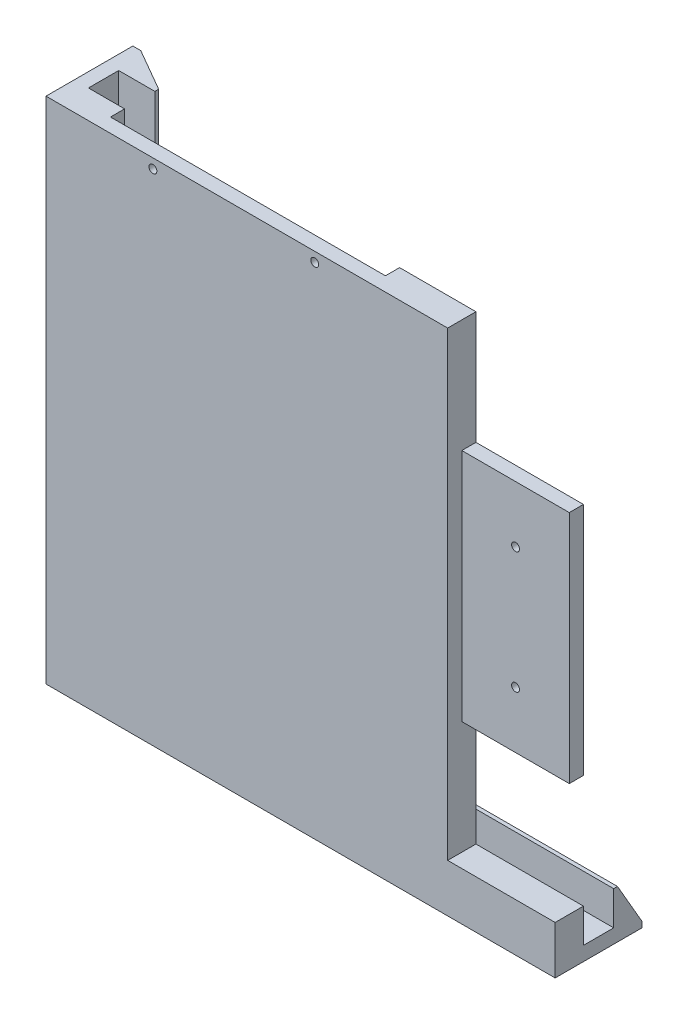
from build123d import *

# Parameters (mm, degrees)
CROQUIS1_W              = 180
CROQUIS1_H              = 180
SALIENTE_EXTRUIR1_DEPTH = 30.7
CROQUIS2_W              = 162.21
CROQUIS2_H              = 162.99
CORTAR_EXTRUIR1_DEPTH   = 20.7
CROQUIS4_W              = 175
CROQUIS4_H              = 10.7
CORTAR_EXTRUIR2_DEPTH   = 175
CROQUIS5_W              = 38
CROQUIS5_H              = 40
CORTAR_EXTRUIR3_DEPTH   = 10
CROQUIS6_W              = 38
CROQUIS6_H              = 82.99
CORTAR_EXTRUIR4_DEPTH   = 5
CROQUIS7_W              = 97.21
CROQUIS7_H              = 6.8
CORTAR_EXTRUIR5_DEPTH   = 5
CHAFL_N1_SIZE           = 15
CHAFL_N1_SIZE2          = 8.660254038
CROQUIS8_R              = 1.4
CORTAR_EXTRUIR6_DEPTH   = 20


with BuildPart() as part:
    # Croquis1 → Saliente-Extruir1 (new body)
    with BuildSketch(Plane.XY):
        with Locations((90, 90)):
            Rectangle(CROQUIS1_W, CROQUIS1_H)
    extrude(amount=SALIENTE_EXTRUIR1_DEPTH)

    # Croquis2 → Cortar-Extruir1 (cut)
    with BuildSketch(Plane(origin=(0, 0, 0), x_dir=(-1, 0, 0), z_dir=(0, 0, -1))):
        with Locations((-98.895, 98.505)):
            Rectangle(CROQUIS2_W, CROQUIS2_H)
    extrude(amount=-CORTAR_EXTRUIR1_DEPTH, mode=Mode.SUBTRACT)

    # Croquis4 → Cortar-Extruir2 (cut)
    with BuildSketch(Plane(origin=(0, 180, 0), x_dir=(1, 0, 0), z_dir=(0, 1, 0))):
        with Locations((92.5, -15.35)):
            Rectangle(CROQUIS4_W, CROQUIS4_H)
    extrude(amount=-CORTAR_EXTRUIR2_DEPTH, mode=Mode.SUBTRACT)

    # Croquis5 → Cortar-Extruir3 (cut)
    with BuildSketch(Plane(origin=(0, 0, 20.7), x_dir=(-1, 0, 0), z_dir=(0, 0, -1))):
        with Locations((-161, 160)):
            Rectangle(CROQUIS5_W, CROQUIS5_H)
        with Locations((-161, 37.01)):
            Rectangle(CROQUIS5_W, CROQUIS5_H)
    extrude(amount=-CORTAR_EXTRUIR3_DEPTH, mode=Mode.SUBTRACT)

    # Croquis6 → Cortar-Extruir4 (cut)
    with BuildSketch(Plane.XY.offset(30.7)):
        with Locations((161, 98.505)):
            Rectangle(CROQUIS6_W, CROQUIS6_H)
    extrude(amount=-CORTAR_EXTRUIR4_DEPTH, mode=Mode.SUBTRACT)

    # Croquis7 → Cortar-Extruir5 (cut)
    with BuildSketch(Plane(origin=(0, 0, 20.7), x_dir=(-1, 0, 0), z_dir=(0, 0, -1))):
        with Locations((-66.395, 176.6)):
            Rectangle(CROQUIS7_W, CROQUIS7_H)
    extrude(amount=-CORTAR_EXTRUIR5_DEPTH, mode=Mode.SUBTRACT)

    # Chaflán1
    chafl_n1_edges = [part.edges().sort_by_distance(p)[0] for p in [
        (98.895, 17.01, 0),
        (17.79, 98.505, 0),
    ]]
    chafl_n1_side = [part.faces().sort_by_distance(p)[0] for p in [
        (2.545584412, 90, 0),
    ]]
    chamfer(chafl_n1_edges, length=CHAFL_N1_SIZE, length2=CHAFL_N1_SIZE2, reference=chafl_n1_side[0])

    # Croquis8 → Cortar-Extruir6 (cut)
    with BuildSketch(Plane(origin=(0, 0, 20.7), x_dir=(-1, 0, 0), z_dir=(0, 0, -1))):
        with Locations((-37.79, 176.6)):
            Circle(CROQUIS8_R)
        with Locations((-95, 176.6)):
            Circle(CROQUIS8_R)
        with Locations((-161, 120)):
            Circle(CROQUIS8_R)
        with Locations((-161, 77.01)):
            Circle(CROQUIS8_R)
    extrude(amount=-CORTAR_EXTRUIR6_DEPTH, mode=Mode.SUBTRACT)


solid = part.part
